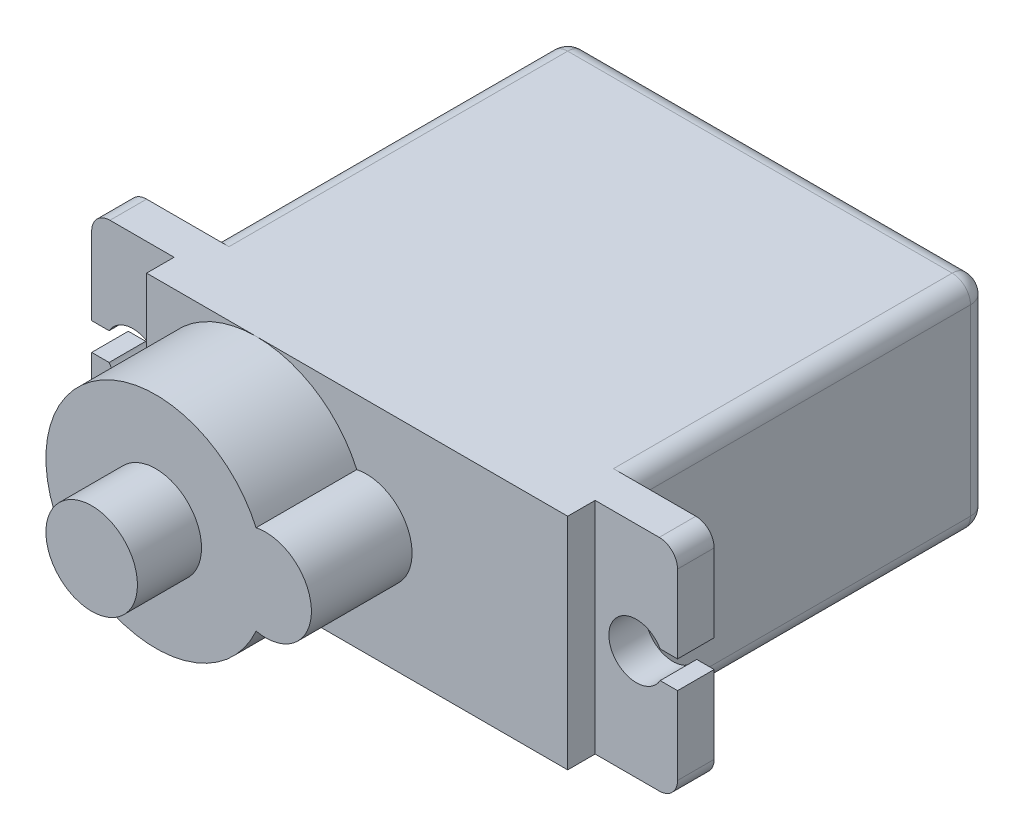
from build123d import *

# Parameters (mm, degrees)
SKETCH1_W           = 23
SKETCH1_H           = 12
BOSS_EXTRUDE1_DEPTH = 32
SKETCH2_W           = 4.5
SKETCH2_H           = 2
BOSS_EXTRUDE2_DEPTH = 12
CUT_EXTRUDE1_DEPTH  = 37.912057651
SKETCH4_W           = 23
SKETCH4_H           = 12
SKETCH4_R           = 2.5
CUT_EXTRUDE2_DEPTH  = 3.5
CUT_EXTRUDE3_DEPTH  = 5.5
FILLET1_R           = 1


with BuildPart() as part:
    # Sketch1 → Boss-Extrude1 (new body)
    with BuildSketch(Plane.XY):
        with Locations((11.5, 6)):
            Rectangle(SKETCH1_W, SKETCH1_H)
    extrude(amount=BOSS_EXTRUDE1_DEPTH)

    # Sketch2 → Boss-Extrude2 (add)
    with BuildSketch(Plane.XZ):
        with Locations((-2.25, 20.5)):
            Rectangle(SKETCH2_W, SKETCH2_H)
        with Locations((25.25, 20.5)):
            Rectangle(SKETCH2_W, SKETCH2_H)
    extrude(amount=-BOSS_EXTRUDE2_DEPTH)

    # Sketch3 → Cut-Extrude1 (cut, through all)
    with BuildSketch(Plane.XY.offset(21.5)):
        with BuildLine():
            Line((-3.549038106, 6.75), (-4.5, 6.75))
            Line((-4.5, 6.75), (-4.5, 5.25))
            Line((-4.5, 5.25), (-3.549038106, 5.25))
            ThreePointArc((-3.549038106, 5.25), (-0.75, 6), (-3.549038106, 6.75))
        make_face()
        with BuildLine():
            Line((26.549038106, 6.75), (27.5, 6.75))
            Line((27.5, 6.75), (27.5, 5.25))
            Line((27.5, 5.25), (26.549038106, 5.25))
            ThreePointArc((26.549038106, 5.25), (23.75, 6), (26.549038106, 6.75))
        make_face()
    extrude(amount=-CUT_EXTRUDE1_DEPTH, mode=Mode.SUBTRACT)

    # Sketch4 → Cut-Extrude2 (cut)
    with BuildSketch(Plane.XY.offset(32)):
        with Locations((11.5, 6)):
            Rectangle(SKETCH4_W, SKETCH4_H)
        with Locations((6, 6)):
            Circle(SKETCH4_R, mode=Mode.SUBTRACT)
    extrude(amount=-CUT_EXTRUDE2_DEPTH, mode=Mode.SUBTRACT)

    # Sketch5 → Cut-Extrude3 (cut)
    with BuildSketch(Plane.XY.offset(28.5)):
        with BuildLine():
            ThreePointArc((11.479166667, 3.554855293), (9.2656647, 0.966568361), (6.000000021, 0))
            Line((6.000000021, 0), (23, 0))
            Line((23, 0), (23, 12))
            Line((23, 12), (6.000000023, 12))
            ThreePointArc((6.000000023, 12), (9.265664701, 11.033431639), (11.479166667, 8.445144707))
            ThreePointArc((11.479166667, 8.445144707), (14.5, 6), (11.479166667, 3.554855293))
        make_face()
        with BuildLine():
            Line((0, 12), (0, 6.000000008))
            ThreePointArc((0, 6.000000008), (1.757359324, 10.242640698), (6.000000023, 12))
            Line((6.000000023, 12), (0, 12))
        make_face()
        with BuildLine():
            Line((0, 6.000000008), (0, 0))
            Line((0, 0), (6.000000021, 0))
            ThreePointArc((6.000000021, 0), (1.757359317, 1.757359308), (0, 6.000000008))
        make_face()
    extrude(amount=-CUT_EXTRUDE3_DEPTH, mode=Mode.SUBTRACT)

    # Fillet1
    fillet1_edges = [part.edges().sort_by_distance(p)[0] for p in [
        (23, 6, 0),
        (11.5, 12, 0),
        (0, 6, 0),
        (11.5, 0, 0),
        (27.5, 0, 20.5),
        (27.5, 12, 20.5),
        (-4.5, 12, 20.5),
        (-4.5, 0, 20.5),
        (0, 0, 9.75),
        (23, 0, 9.75),
        (23, 12, 9.75),
        (0, 12, 9.75),
    ]]
    fillet(fillet1_edges, radius=FILLET1_R)


solid = part.part
